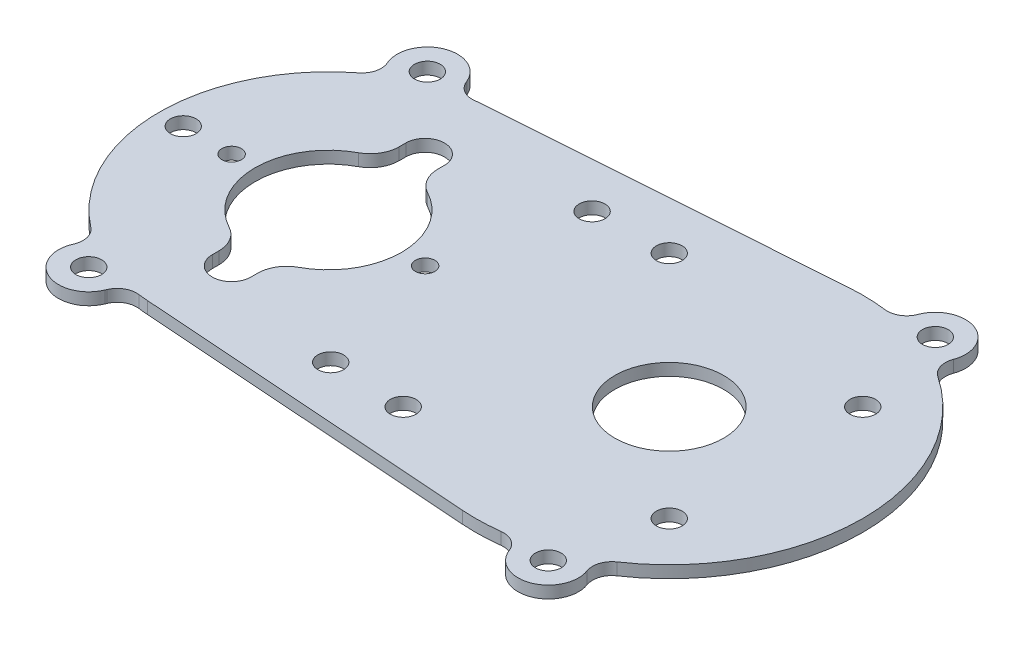
from build123d import *

# Parameters (mm, degrees)
SKETCH1_R               = 14.28115
SKETCH1_R_2             = 19.2405
BOSS_EXTRUDE1_DEPTH     = 3.175
F_10_CLEARANCE_HOLE1_D  = 5.1054
F_1_4_CLEARANCE_HOLE1_D = 6.7564
SKETCH6_R               = 2.5527
CUT_EXTRUDE1_DEPTH      = 150.23740385
FILLET1_R               = 7.62
BOSS_EXTRUDE3_START     = -3.175
BOSS_EXTRUDE3_DEPTH     = 3.175
FILLET2_R               = 5.08
F_1_4_CLEARANCE_HOLE2_D = 6.7564


with BuildPart() as part:
    # Sketch1 → Boss-Extrude1 (new body)
    with BuildSketch(Plane(origin=(0, 0, 0), x_dir=(1, 0, 0), z_dir=(0, 1, 0))):
        with BuildLine():
            Line((85.884602434, 50.671947857), (-3.15409287, 44.337954375))
            ThreePointArc((-3.15409287, 44.337954375), (-44.45, 0), (-3.15409287, -44.337954375))
            Line((-3.15409287, -44.337954375), (85.884602434, -50.671947857))
            ThreePointArc((85.884602434, -50.671947857), (140.28928, 0), (85.884602434, 50.671947857))
        make_face()
        with Locations(Location((89.48928, 0, 0), (0, 0, 270))):
            Circle(SKETCH1_R, mode=Mode.SUBTRACT)
        with Locations(Location((0, 0, 0), (0, 0, 270))):
            Circle(SKETCH1_R_2, mode=Mode.SUBTRACT)
    extrude(amount=BOSS_EXTRUDE1_DEPTH)

    # #10 Clearance Hole1 (through all)
    with Locations(Plane(origin=(0, 3.175, 0), x_dir=(1, 0, 0), z_dir=(0, 1, 0))):
        with Locations((0, 25.4), (25.4, 0), (0, -25.4), (-25.4, 0)):
            Hole(F_10_CLEARANCE_HOLE1_D / 2)

    # 1/4 Clearance Hole1 (through all)
    with Locations(Plane(origin=(0, 3.175, 0), x_dir=(1, 0, 0), z_dir=(0, 1, 0))):
        with Locations((54.56428, 34.925), (54.56428, -34.925), (114.88928, 25.4), (114.88928, -25.4), (-38.1, 0), (34.925, -34.314713318), (34.925, 34.314713318)):
            Hole(F_1_4_CLEARANCE_HOLE1_D / 2)

    # Sketch6 → Cut-Extrude1 (cut, through all)
    # profile 1 of 2: a face of its own
    with BuildSketch(Plane(origin=(0, 3.175, 0), x_dir=(1, 0, 0), z_dir=(0, 1, 0))):
        with BuildLine():
            Line((5.08, 18.55775957), (5.08, 25.4))
            ThreePointArc((5.08, 25.4), (0, 30.48), (-5.08, 25.4))
            Line((-5.08, 25.4), (-5.08, 18.55775957))
            ThreePointArc((-5.08, 18.55775957), (0, 19.2405), (5.08, 18.55775957))
        make_face()
        with Locations((0, 25.4)):
            Circle(SKETCH6_R, mode=Mode.SUBTRACT)
    # profile 2 of 2: a face of its own
    with BuildSketch(Plane(origin=(0, 3.175, 0), x_dir=(1, 0, 0), z_dir=(0, 1, 0))):
        with BuildLine():
            ThreePointArc((5.08, -18.55775957), (0, -19.2405), (-5.08, -18.55775957))
            Line((-5.08, -18.55775957), (-5.08, -25.4))
            ThreePointArc((-5.08, -25.4), (0, -30.48), (5.08, -25.4))
            Line((5.08, -25.4), (5.08, -18.55775957))
        make_face()
        with Locations((0, -25.4)):
            Circle(SKETCH6_R, mode=Mode.SUBTRACT)
    extrude(amount=-CUT_EXTRUDE1_DEPTH, mode=Mode.SUBTRACT)

    # Fillet1
    fillet1_edges = [part.edges().sort_by_distance(p)[0] for p in [
        (-5.08, 1.5875, 18.55775957),
        (5.08, 1.5875, 18.55775957),
        (5.08, 1.5875, -18.55775957),
        (-5.08, 1.5875, -18.55775957),
    ]]
    fillet(fillet1_edges, radius=FILLET1_R)

    # Sketch8 → Boss-Extrude3 (add)
    with BuildSketch(Plane(origin=(0, 3.175, 0), x_dir=(1, 0, 0), z_dir=(0, 1, 0)).offset(BOSS_EXTRUDE3_START)):
        with BuildLine():
            Line((114.539380559, -44.194258247), (115.971392847, -48.012957682))
            ThreePointArc((115.971392847, -48.012957682), (111.326322318, -58.232112847), (101.107167153, -53.587042318))
            Line((101.107167153, -53.587042318), (99.675154865, -49.768342882))
            ThreePointArc((99.675154865, -49.768342882), (107.326350833, -47.565522221), (114.539380559, -44.194258247))
        make_face()
        with BuildLine():
            Line((99.675154865, 49.768342882), (101.107167153, 53.587042318))
            ThreePointArc((101.107167153, 53.587042318), (111.326322318, 58.232112847), (115.971392847, 48.012957682))
            Line((115.971392847, 48.012957682), (114.539380559, 44.194258247))
            ThreePointArc((114.539380559, 44.194258247), (107.326350833, 47.565522221), (99.675154865, 49.768342882))
        make_face()
        with BuildLine():
            Line((-9.444374405, -43.435081353), (-11.130282191, -47.494435543))
            ThreePointArc((-11.130282191, -47.494435543), (-21.505155543, -51.780437809), (-25.791157809, -41.405564457))
            Line((-25.791157809, -41.405564457), (-24.105250023, -37.346210267))
            ThreePointArc((-24.105250023, -37.346210267), (-17.048839039, -41.050451732), (-9.444374405, -43.435081353))
        make_face()
        with BuildLine():
            Line((-9.444374405, 43.435081353), (-11.130282191, 47.494435543))
            ThreePointArc((-11.130282191, 47.494435543), (-21.505155543, 51.780437809), (-25.791157809, 41.405564457))
            Line((-25.791157809, 41.405564457), (-24.105250023, 37.346210267))
            ThreePointArc((-24.105250023, 37.346210267), (-17.048839039, 41.050451732), (-9.444374405, 43.435081353))
        make_face()
    extrude(amount=BOSS_EXTRUDE3_DEPTH)

    # Fillet2
    fillet2_edges = [part.edges().sort_by_distance(p)[0] for p in [
        (99.675154865, 1.5875, -49.768342882),
        (114.539380559, 1.5875, -44.194258247),
        (-9.444374405, 1.5875, -43.435081353),
        (-24.105250023, 1.5875, -37.346210267),
        (-24.105250023, 1.5875, 37.346210267),
        (-9.444374405, 1.5875, 43.435081353),
        (114.539380559, 1.5875, 44.194258247),
        (99.675154865, 1.5875, 49.768342882),
    ]]
    fillet(fillet2_edges, radius=FILLET2_R)

    # 1/4 Clearance Hole2 (through all)
    with Locations(Plane(origin=(0, 3.175, 0), x_dir=(1, 0, 0), z_dir=(0, 1, 0))):
        with Locations((108.53928, -50.8), (-18.46072, -44.45), (-18.46072, 44.45), (108.53928, 50.8)):
            Hole(F_1_4_CLEARANCE_HOLE2_D / 2)


solid = part.part
